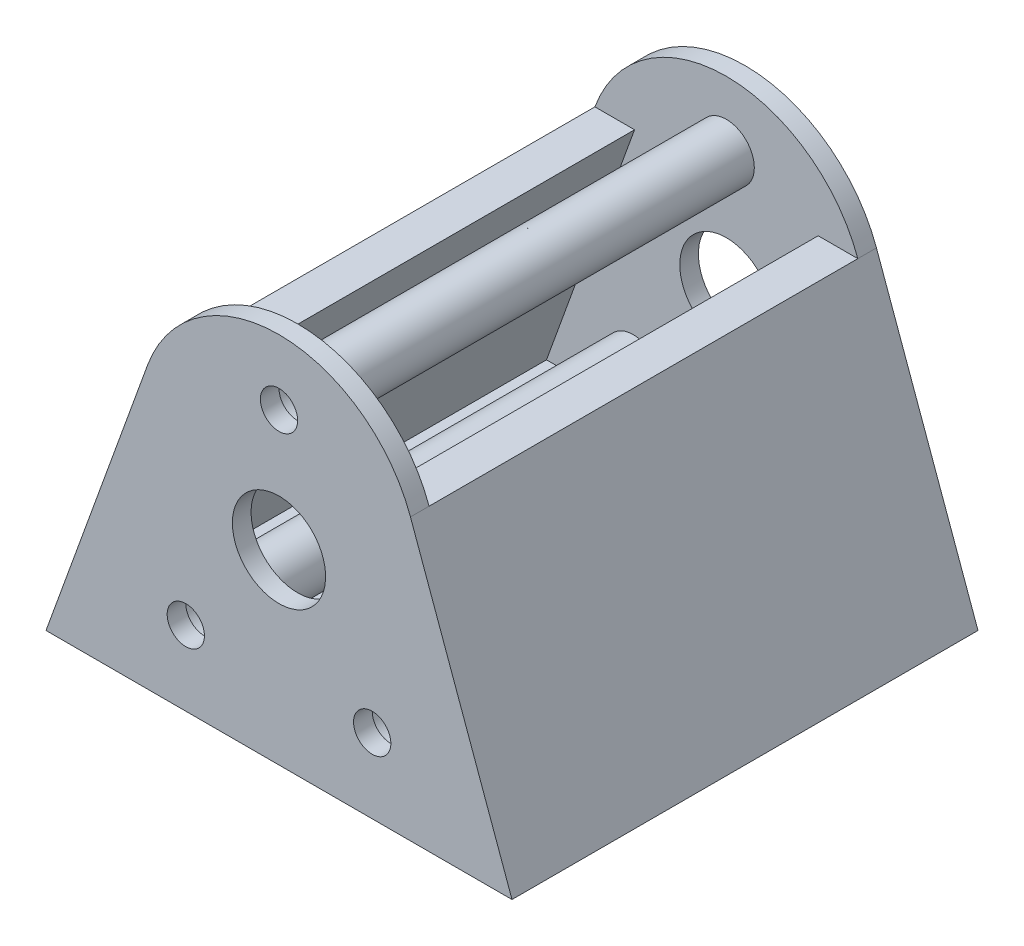
from build123d import *

# Parameters (mm, degrees)
SKETCH1_R           = 5
SKETCH1_R_2         = 2
BOSS_EXTRUDE1_DEPTH = 2
SKETCH2_R           = 2
SKETCH2_R_2         = 5
BOSS_EXTRUDE2_DEPTH = 2
BOSS_EXTRUDE3_DEPTH = 46
SKETCH7_R           = 3
SKETCH7_R_2         = 2.5
BOSS_EXTRUDE4_DEPTH = 46
BOSS_EXTRUDE5_DEPTH = 46
SKETCH10_R          = 5
SKETCH10_R_2        = 2.5
BOSS_EXTRUDE6_DEPTH = 5


with BuildPart() as part:
    # Sketch1 → Boss-Extrude1 (new body)
    with BuildSketch(Plane.XY):
        with BuildLine():
            Line((-25, 0), (25, 0))
            Line((25, 0), (14.104686356, 30.104686356))
            ThreePointArc((14.104686356, 30.104686356), (0, 40), (-14.104686356, 30.104686356))
            Line((-14.104686356, 30.104686356), (-25, 0))
        make_face()
        with Locations((0, 20)):
            Circle(SKETCH1_R, mode=Mode.SUBTRACT)
        with Locations((-10, 8)):
            Circle(SKETCH1_R_2, mode=Mode.SUBTRACT)
        with Locations((10, 8)):
            Circle(SKETCH1_R_2, mode=Mode.SUBTRACT)
        with Locations((0, 33)):
            Circle(SKETCH1_R_2, mode=Mode.SUBTRACT)
    extrude(amount=BOSS_EXTRUDE1_DEPTH)



with BuildPart() as body_2:
    # Sketch2 → Boss-Extrude2 (new body)
    with BuildSketch(Plane(origin=(0, 0, 50), x_dir=(-1, 0, 0), z_dir=(0, 0, -1))):
        with BuildLine():
            Line((-25, 0), (25, 0))
            Line((25, 0), (14.104686356, 30.104686356))
            ThreePointArc((14.104686356, 30.104686356), (0, 40), (-14.104686356, 30.104686356))
            Line((-14.104686356, 30.104686356), (-25, 0))
        make_face()
        with Locations(Location((-10, 8, 0), (0, 0, 180))):
            Circle(SKETCH2_R, mode=Mode.SUBTRACT)
        with Locations(Location((10, 8, 0), (0, 0, 180))):
            Circle(SKETCH2_R, mode=Mode.SUBTRACT)
        with Locations(Location((0, 33, 0), (0, 0, 180))):
            Circle(SKETCH2_R, mode=Mode.SUBTRACT)
        with Locations(Location((0, 20, 0), (0, 0, 180))):
            Circle(SKETCH2_R_2, mode=Mode.SUBTRACT)
    extrude(amount=BOSS_EXTRUDE2_DEPTH)


with BuildPart() as part_1:
    add(part.part)

    add(body_2.part)  # Boss-Extrude3 merges body 2
    # Sketch4 → Boss-Extrude3 (add)
    with BuildSketch(Plane(origin=(0, 0, 48), x_dir=(-1, 0, 0), z_dir=(0, 0, -1))):
        Polygon((-25, 0), (25, 0), (23.552343178, 4), (-23.552343178, 4), align=None)
    extrude(amount=BOSS_EXTRUDE3_DEPTH)

    # Sketch7 → Boss-Extrude4 (add)
    # profile 1 of 3: a face of its own
    with BuildSketch(Plane(origin=(0, 0, 48), x_dir=(-1, 0, 0), z_dir=(0, 0, -1))):
        with Locations(Location((10, 8, 0), (0, 0, 180))):
            Circle(SKETCH7_R)
        with Locations(Location((10, 8, 0), (0, 0, 180))):
            Circle(SKETCH7_R_2, mode=Mode.SUBTRACT)
    # profile 2 of 3: a face of its own
    with BuildSketch(Plane(origin=(0, 0, 48), x_dir=(-1, 0, 0), z_dir=(0, 0, -1))):
        with Locations(Location((0, 33, 0), (0, 0, 180))):
            Circle(SKETCH7_R)
        with Locations(Location((0, 33, 0), (0, 0, 180))):
            Circle(SKETCH7_R_2, mode=Mode.SUBTRACT)
    # profile 3 of 3: a face of its own
    with BuildSketch(Plane(origin=(0, 0, 48), x_dir=(-1, 0, 0), z_dir=(0, 0, -1))):
        with Locations(Location((-10, 8, 0), (0, 0, 180))):
            Circle(SKETCH7_R)
        with Locations(Location((-10, 8, 0), (0, 0, 180))):
            Circle(SKETCH7_R_2, mode=Mode.SUBTRACT)
    extrude(amount=BOSS_EXTRUDE4_DEPTH)

    # Sketch5 → Boss-Extrude5 (add)
    with BuildSketch(Plane(origin=(0, 0, 48), x_dir=(-1, 0, 0), z_dir=(0, 0, -1))):
        Polygon((19.298437881, 4), (9.850781059, 30.104686356), (14.104686356, 30.104686356), (23.552343178, 4), align=None)
        Polygon((-23.552343178, 4), (-19.298437881, 4), (-9.850781059, 30.104686356), (-14.104686356, 30.104686356), align=None)
    extrude(amount=BOSS_EXTRUDE5_DEPTH)

    # Sketch10 → Boss-Extrude6 (add)
    # profile 1 of 4: a face of its own
    with BuildSketch(Plane.XZ):
        with Locations(Location((-12.5, 12.5, 0), (0, 0, 90))):
            Circle(SKETCH10_R)
        with Locations(Location((-12.5, 12.5, 0), (0, 0, 270))):
            Circle(SKETCH10_R_2, mode=Mode.SUBTRACT)
    # profile 2 of 4: a face of its own
    with BuildSketch(Plane.XZ):
        with Locations(Location((-12.5, 37.5, 0), (0, 0, 90))):
            Circle(SKETCH10_R)
        with Locations(Location((-12.5, 37.5, 0), (0, 0, 90))):
            Circle(SKETCH10_R_2, mode=Mode.SUBTRACT)
    # profile 3 of 4: a face of its own
    with BuildSketch(Plane.XZ):
        with Locations(Location((12.5, 37.5, 0), (0, 0, 90))):
            Circle(SKETCH10_R)
        with Locations(Location((12.5, 37.5, 0), (0, 0, 270))):
            Circle(SKETCH10_R_2, mode=Mode.SUBTRACT)
    # profile 4 of 4: a face of its own
    with BuildSketch(Plane.XZ):
        with Locations(Location((12.5, 12.5, 0), (0, 0, 90))):
            Circle(SKETCH10_R)
        with Locations(Location((12.5, 12.5, 0), (0, 0, 90))):
            Circle(SKETCH10_R_2, mode=Mode.SUBTRACT)
    extrude(amount=BOSS_EXTRUDE6_DEPTH)


solid = part_1.part
